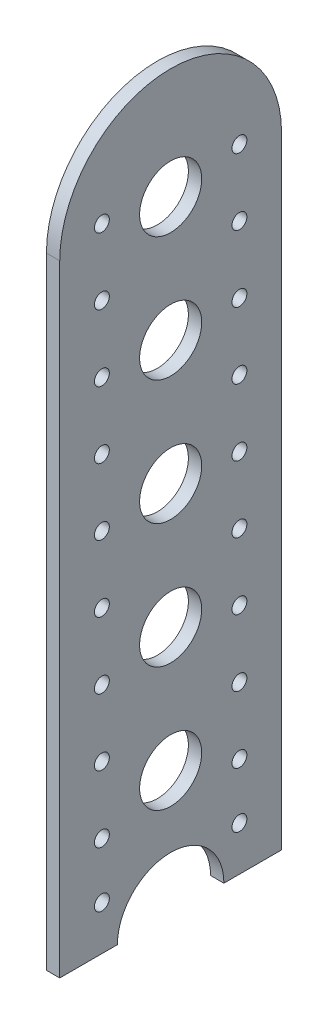
from build123d import *

# Parameters (mm, degrees)
SKETCH1_R           = 7.000001147
SKETCH1_R_2         = 6.999995031
SKETCH1_R_3         = 6.99997314
SKETCH1_R_4         = 6.999932994
SKETCH1_R_5         = 6.999971052
BOSS_EXTRUDE1_DEPTH = 3
SKETCH2_R           = 1.68
CUT_EXTRUDE3_DEPTH  = 88.676834918
SKETCH4_R           = 1.68
CUT_EXTRUDE4_DEPTH  = 88.676834918
LPATTERN2_COUNT     = 9
LPATTERN2_PITCH     = 15


with BuildPart() as part:
    # Sketch1 → Boss-Extrude1 (new body)
    with BuildSketch(Plane(origin=(0, 0, 0), x_dir=(0, 0, -1), z_dir=(1, 0, 0))):
        with BuildLine():
            Line((-25.094868708, -83.955196062), (-12.09486844, -83.955196062))
            ThreePointArc((-12.09486844, -83.955196062), (-0.094868335, -71.955195958), (11.905131769, -83.955196062))
            Line((11.905131769, -83.955196062), (24.905132037, -83.955196062))
            Line((24.905132037, -83.955196062), (24.905132037, 56.044804534))
            ThreePointArc((24.905132037, 56.044804534), (-0.094868335, 81.044804907), (-25.094868708, 56.044804534))
            Line((-25.094868708, 56.044804534), (-25.094868708, -83.955196062))
        make_face()
        with Locations((-0.094868335, -55.955176125)):
            Circle(SKETCH1_R, mode=Mode.SUBTRACT)
        with Locations((-0.094836539, -27.955201843)):
            Circle(SKETCH1_R_2, mode=Mode.SUBTRACT)
        with Locations((-0.094922892, 0.044802449)):
            Circle(SKETCH1_R_3, mode=Mode.SUBTRACT)
        with Locations((-0.094806508, 28.044865497)):
            Circle(SKETCH1_R_4, mode=Mode.SUBTRACT)
        with Locations((-0.094868335, 56.044746985)):
            Circle(SKETCH1_R_5, mode=Mode.SUBTRACT)
    extrude(amount=BOSS_EXTRUDE1_DEPTH)

    # Sketch2 → Cut-Extrude3 (cut, through all)
    with BuildSketch(Plane(origin=(3, 0, 0), x_dir=(0, 0, -1), z_dir=(1, 0, 0))):
        with Locations((-15.594868708, -73.955196062)):
            Circle(SKETCH2_R)
        with Locations((15.405132037, -73.955196062)):
            Circle(SKETCH2_R)
    extrude(amount=-CUT_EXTRUDE3_DEPTH, mode=Mode.SUBTRACT)

    # Sketch4 → Cut-Extrude4 (cut, through all)
    with BuildSketch(Plane(origin=(3, 0, 0), x_dir=(0, 0, -1), z_dir=(1, 0, 0))):
        with Locations((-15.594868708, -61.455196062)):
            Circle(SKETCH4_R)
        with Locations((15.405132037, -61.455196062)):
            Circle(SKETCH4_R)
    cut_extrude4 = extrude(amount=-CUT_EXTRUDE4_DEPTH, mode=Mode.SUBTRACT)

    # LPattern2: Cut-Extrude4 ×9
    with Locations(*[(0, i * LPATTERN2_PITCH, 0) for i in range(1, LPATTERN2_COUNT)]):
        add(cut_extrude4, mode=Mode.SUBTRACT)


solid = part.part
